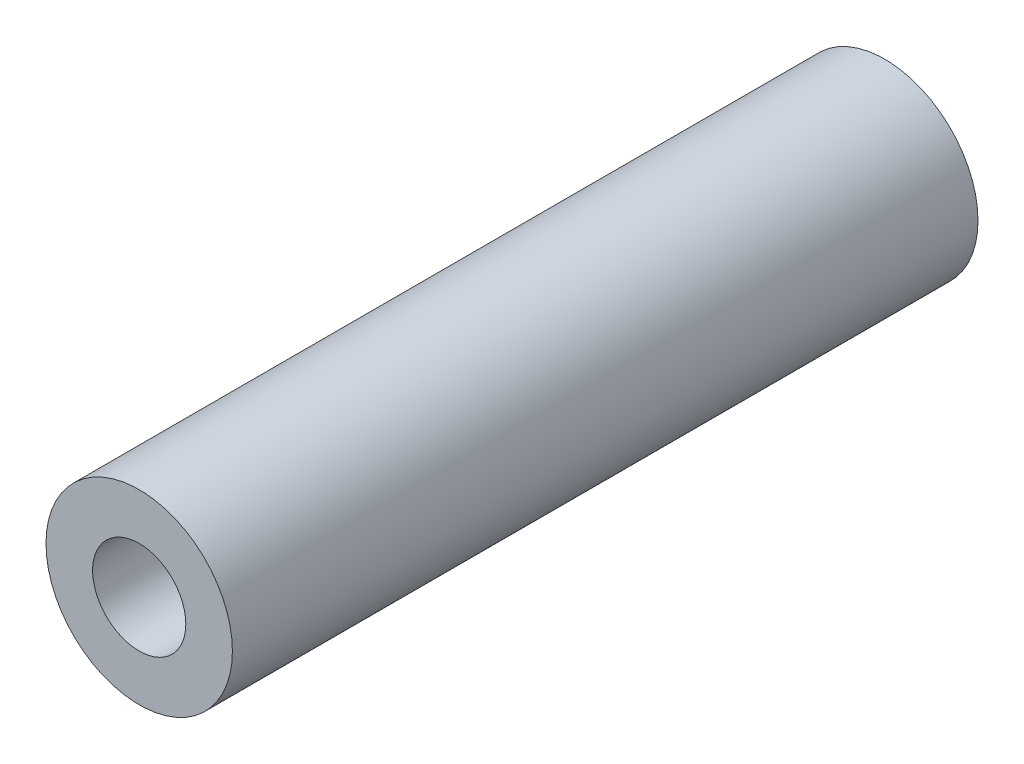
from build123d import *

# Parameters (mm, degrees)
SKETCH1_R                 = 2.5
BOSS_EXTRUDE1_DEPTH       = 10
M3X0_5_TAPPED_HOLE1_D     = 2.5
M3X0_5_TAPPED_HOLE1_DEPTH = 10


with BuildPart() as part:
    # Sketch1 → Boss-Extrude1 (new, symmetric)
    with BuildSketch(Plane.XY):
        Circle(SKETCH1_R)
    extrude(amount=BOSS_EXTRUDE1_DEPTH, both=True)

    # M3x0.5 Tapped Hole1
    with Locations(Plane.XY.offset(10)):
        with Locations((0, 0)):
            m3x0_5_tapped_hole1 = Hole(M3X0_5_TAPPED_HOLE1_D / 2, depth=M3X0_5_TAPPED_HOLE1_DEPTH)

    # Mirror1: M3x0.5 Tapped Hole1 across plane
    add(m3x0_5_tapped_hole1.mirror(Plane.XY), mode=Mode.SUBTRACT)


solid = part.part
